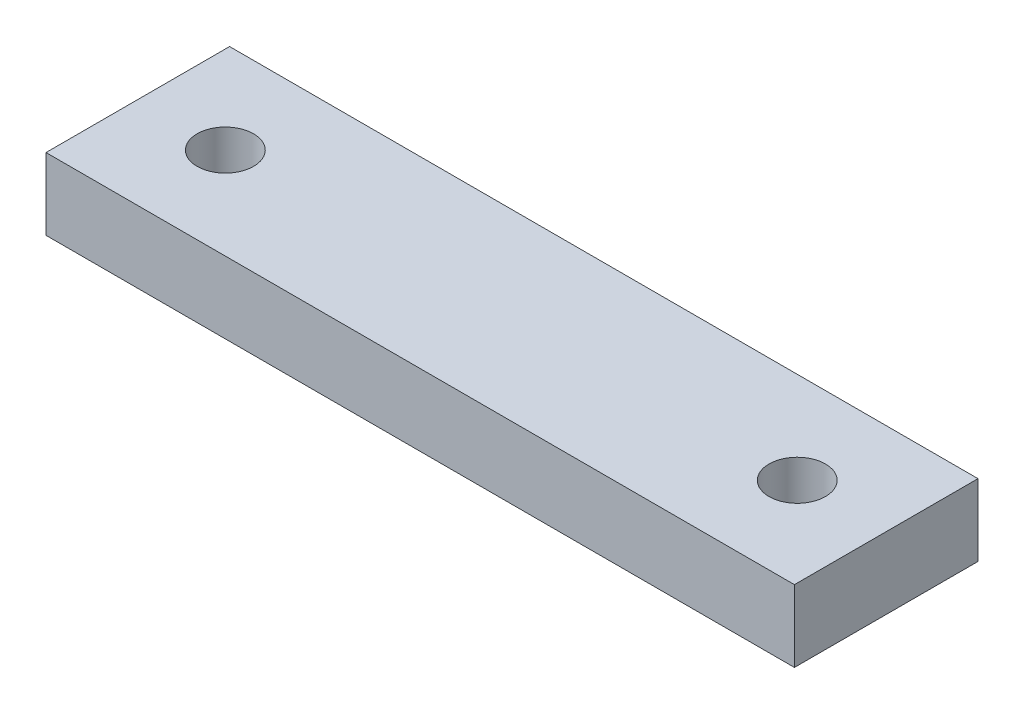
from build123d import *

# Parameters (mm, degrees)
SKETCH1_W           = 26.5
SKETCH1_H           = 6.5
SKETCH1_R           = 1
BOSS_EXTRUDE1_DEPTH = 2.54


with BuildPart() as part:
    # Sketch1 → Boss-Extrude1 (new body)
    with BuildSketch(Plane(origin=(0, 0, 0), x_dir=(1, 0, 0), z_dir=(0, 1, 0))):
        with Locations((13.25, 3.25)):
            Rectangle(SKETCH1_W, SKETCH1_H)
        with Locations(Location((3.1, 3.25, 0), (0, 0, 270))):
            Circle(SKETCH1_R, mode=Mode.SUBTRACT)
        with Locations(Location((23.35, 3.25, 0), (0, 0, 270))):
            Circle(SKETCH1_R, mode=Mode.SUBTRACT)
    extrude(amount=BOSS_EXTRUDE1_DEPTH)


solid = part.part
